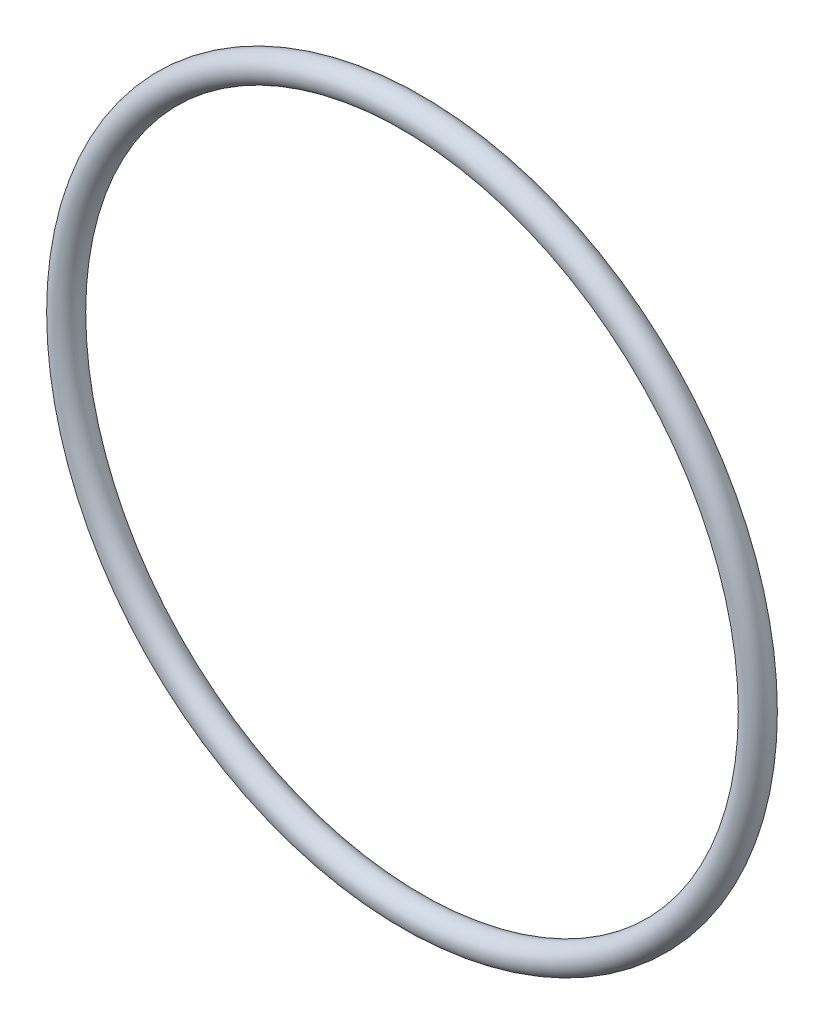
from build123d import *

# Parameters (mm, degrees)
SKETCH2_R = 0.5


with BuildPart() as part:
    # Sketch2 → Revolve1 (revolve)
    with BuildSketch(Plane(origin=(0, 0, 0), x_dir=(1, 0, 0), z_dir=(0, 1, 0)), mode=Mode.PRIVATE) as revolve1_sk:
        with Locations((12.5, 0)):
            Circle(SKETCH2_R)
    revolve(revolve1_sk.sketch.rotate(Axis((0, 0, -0.5), (0, 0, 1)), 180), axis=Axis((0, 0, -0.5), (0, 0, 1)))


solid = part.part
